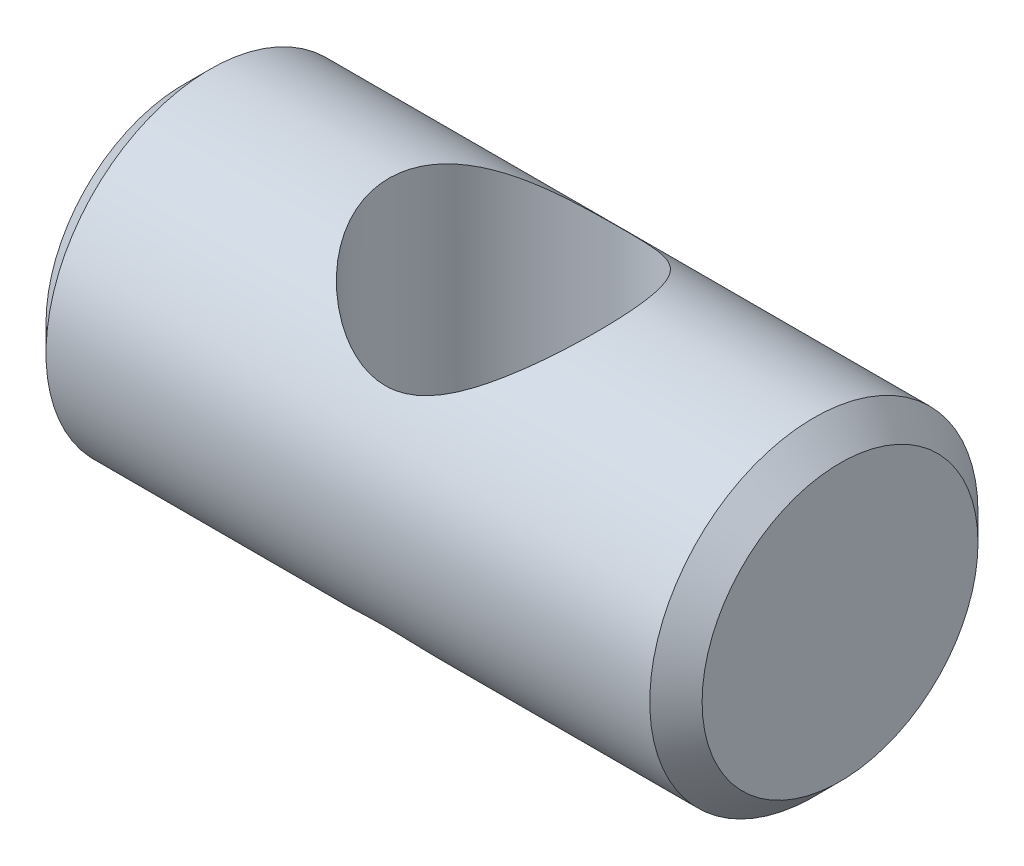
from build123d import *

# Parameters (mm, degrees)
SKETCH1_R           = 4.765
BOSS_EXTRUDE1_DEPTH = 9.525
CHAMFER1_SIZE       = 0.76
SKETCH2_R           = 3.43
CUT_EXTRUDE1_DEPTH  = 22.025


with BuildPart() as part:
    # Sketch1 → Boss-Extrude1 (new, symmetric)
    with BuildSketch(Plane(origin=(0, 0, 0), x_dir=(0, 0, -1), z_dir=(1, 0, 0))):
        with Locations(Location((0, 0, 0), (0, 0, 180))):
            Circle(SKETCH1_R)
    extrude(amount=BOSS_EXTRUDE1_DEPTH, both=True)

    # Chamfer1
    chamfer1_edges = [part.edges().sort_by_distance(p)[0] for p in [
        (-9.525, 0, -4.765),
        (9.525, 0, -4.765),
    ]]
    chamfer(chamfer1_edges, length=CHAMFER1_SIZE)

    # Sketch2 → Cut-Extrude1 (cut, symmetric)
    with BuildSketch(Plane(origin=(0, 0, 0), x_dir=(1, 0, 0), z_dir=(0, 1, 0))):
        with Locations(Location((0, -0.25, 0), (0, 0, 270))):
            Circle(SKETCH2_R)
    extrude(amount=CUT_EXTRUDE1_DEPTH, both=True, mode=Mode.SUBTRACT)


solid = part.part
